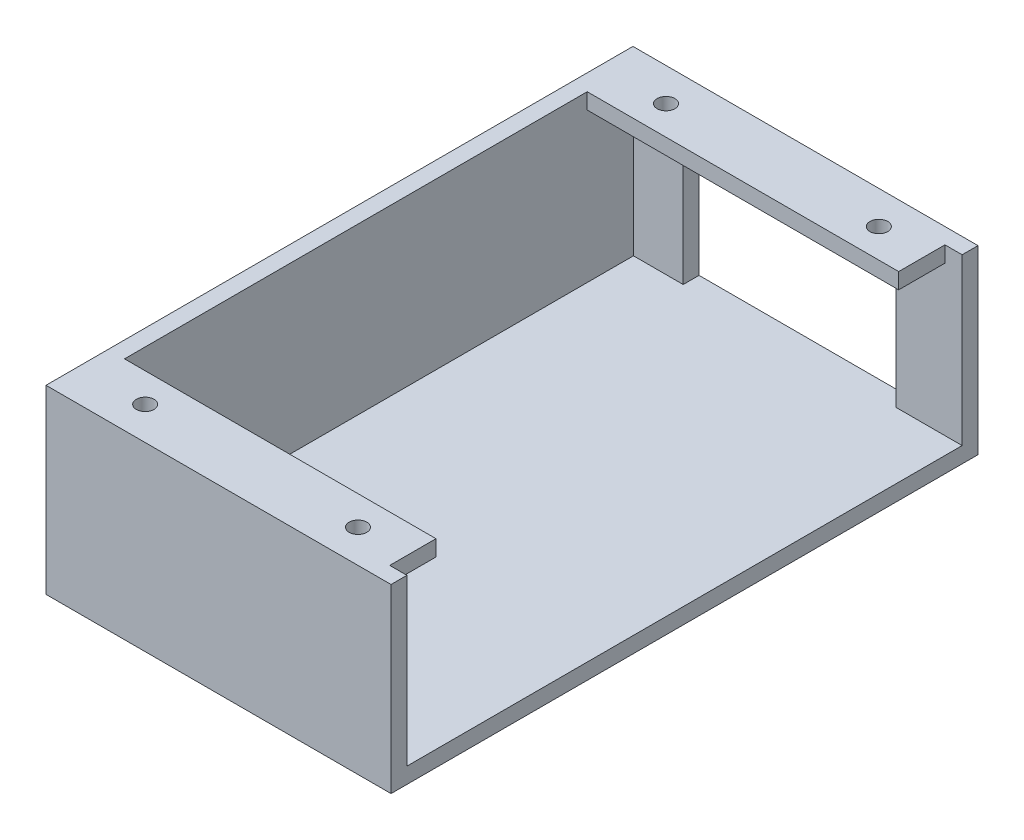
from build123d import *

# Parameters (mm, degrees)
SKETCH1_W                = 66.294
SKETCH1_H                = 112.776
BOSS_EXTRUDE1_DEPTH      = 3.048
SKETCH2_W                = 66.294
SKETCH2_H                = 112.776
SKETCH2_W_2              = 60
SKETCH2_H_2              = 106.68
BOSS_EXTRUDE2_DEPTH      = 31.75
SKETCH3_W                = 60
SKETCH3_H                = 8.89
BOSS_EXTRUDE3_DEPTH      = 3.048
SKETCH6_W                = 106.68
SKETCH6_H                = 31.75
CUT_EXTRUDE1_DEPTH       = 3.302
M3_CLEARANCE_HOLE1_D     = 3.4
M3_CLEARANCE_HOLE1_DEPTH = 3.048
CUT_EXTRUDE4_REACH       = 124.589
SKETCH12_W               = 40.894
SKETCH12_H               = 20.32
SKETCH13_W               = 17.78
SKETCH13_H               = 5.08
BOSS_EXTRUDE4_DEPTH      = 5.08
SKETCH14_W               = 17.78
SKETCH14_H               = 2.54
BOSS_EXTRUDE6_DEPTH      = 5.08


with BuildPart() as part:
    # Sketch1 → Boss-Extrude1 (new body)
    with BuildSketch(Plane(origin=(0, 0, 0), x_dir=(1, 0, 0), z_dir=(0, 1, 0))):
        Rectangle(SKETCH1_W, SKETCH1_H)
    extrude(amount=BOSS_EXTRUDE1_DEPTH)

    # Sketch2 → Boss-Extrude2 (add)
    with BuildSketch(Plane(origin=(0, 3.048, 0), x_dir=(1, 0, 0), z_dir=(0, 1, 0))):
        Rectangle(SKETCH2_W, SKETCH2_H)
        Rectangle(SKETCH2_W_2, SKETCH2_H_2, mode=Mode.SUBTRACT)
    extrude(amount=BOSS_EXTRUDE2_DEPTH)

    # Sketch3 → Boss-Extrude3 (add)
    with BuildSketch(Plane(origin=(0, 34.798, 0), x_dir=(1, 0, 0), z_dir=(0, 1, 0))):
        with Locations((0, 48.895)):
            Rectangle(SKETCH3_W, SKETCH3_H)
        with Locations((0, -48.895)):
            Rectangle(SKETCH3_W, SKETCH3_H)
    extrude(amount=-BOSS_EXTRUDE3_DEPTH)

    # Sketch6 → Cut-Extrude1 (cut)
    with BuildSketch(Plane(origin=(33.147, 0, 0), x_dir=(0, 0, -1), z_dir=(1, 0, 0))):
        with Locations((0, 18.923)):
            Rectangle(SKETCH6_W, SKETCH6_H)
    extrude(amount=-CUT_EXTRUDE1_DEPTH, mode=Mode.SUBTRACT)

    # M3 Clearance Hole1
    with Locations(Plane(origin=(-20.447, 34.798, -50.038), x_dir=(0, 0, 1), z_dir=(0, 1, 0))):
        with Locations((0, 0), (0, 40.894), (100.076, 0), (100.076, 40.894)):
            Hole(M3_CLEARANCE_HOLE1_D / 2, depth=M3_CLEARANCE_HOLE1_DEPTH)

    # Sketch12 → Cut-Extrude4 (cut, up to next)
    with BuildSketch(Plane(origin=(0, 0, -56.388), x_dir=(-1, 0, 0), z_dir=(0, 0, -1)), mode=Mode.PRIVATE) as cut_extrude4_sk1:
        with Locations((0, 13.208)):
            Rectangle(SKETCH12_W, SKETCH12_H)
    cut_extrude4_tool1 = extrude(cut_extrude4_sk1.sketch, amount=-CUT_EXTRUDE4_REACH, mode=Mode.PRIVATE) & part.part
    add(cut_extrude4_tool1.solids().sort_by_distance((0, 13.208, -56.388))[0], mode=Mode.SUBTRACT)

    # Sketch13 → Boss-Extrude4 (add)
    with BuildSketch(Plane.XZ):
        with Locations((0, 12.7)):
            Rectangle(SKETCH13_W, SKETCH13_H)
        with Locations((0, -12.7)):
            Rectangle(SKETCH13_W, SKETCH13_H)
    extrude(amount=BOSS_EXTRUDE4_DEPTH)

    # Sketch14 → Boss-Extrude6 (add)
    with BuildSketch(Plane(origin=(0, 0, 10.16), x_dir=(-1, 0, 0), z_dir=(0, 0, -1))):
        with Locations((0, -3.81)):
            Rectangle(SKETCH14_W, SKETCH14_H)
    boss_extrude6 = extrude(amount=BOSS_EXTRUDE6_DEPTH)

    # Mirror2: Boss-Extrude6 across plane
    add(boss_extrude6.mirror(Plane(origin=(0, 0, 0), x_dir=(1, 0, 0), z_dir=(0, 0, -1))))


solid = part.part
